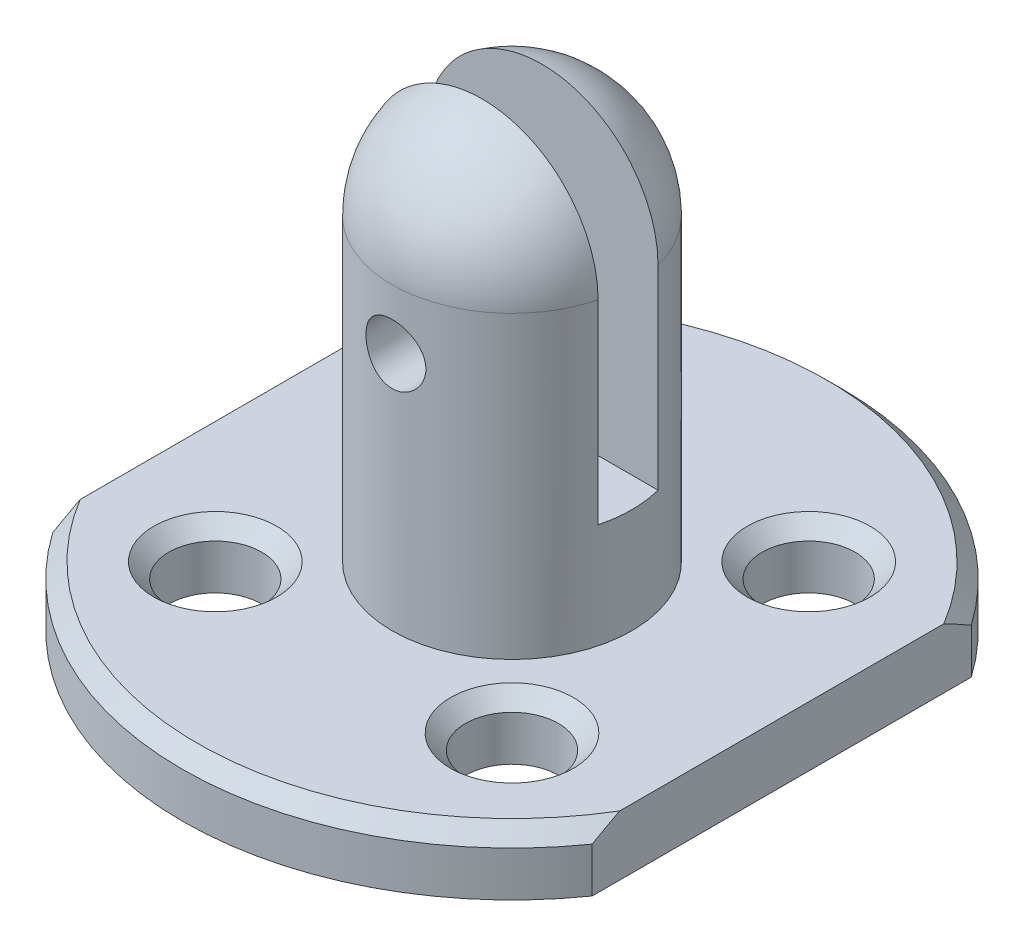
from build123d import *

# Parameters (mm, degrees)
BOSS_EXTRUDE1_DEPTH     = 2
SKETCH2_R               = 1.55
CUT_EXTRUDE1_DEPTH      = 15.352700094
CHAMFER1_SIZE           = 0.5
CUT_EXTRUDE2_DEPTH      = 22.400934559
CUT_EXTRUDE2_DEPTH_BACK = 22.400934559
SKETCH4_W               = 2
SKETCH4_H               = 13.963808783
CUT_EXTRUDE3_DEPTH      = 22.306139967
CUT_EXTRUDE3_DEPTH_BACK = 22.306139967
SKETCH5_R               = 1
SKETCH6_R               = 3
BOSS_EXTRUDE2_DEPTH     = 1


with BuildPart() as part:
    # Sketch1 → Boss-Extrude1 (new body)
    with BuildSketch(Plane(origin=(0, 0, 0), x_dir=(1, 0, 0), z_dir=(0, 1, 0))):
        with BuildLine():
            Line((9, -6.32455532), (9, 6.32455532))
            ThreePointArc((9, 6.32455532), (0, 11), (-9, 6.32455532))
            Line((-9, 6.32455532), (-9, -6.32455532))
            ThreePointArc((-9, -6.32455532), (0, -11), (9, -6.32455532))
        make_face()
    extrude(amount=BOSS_EXTRUDE1_DEPTH)

    # Sketch2 → Cut-Extrude1 (cut, through all)
    with BuildSketch(Plane(origin=(0, 2, 0), x_dir=(1, 0, 0), z_dir=(0, 1, 0))):
        with Locations(Location((4.949747468, 4.949747468, 0), (0, 0, 270))):
            Circle(SKETCH2_R)
        with Locations(Location((4.949747468, -4.949747468, 0), (0, 0, 270))):
            Circle(SKETCH2_R)
        with Locations(Location((-4.949747468, -4.949747468, 0), (0, 0, 270))):
            Circle(SKETCH2_R)
        with Locations(Location((-4.949747468, 4.949747468, 0), (0, 0, 270))):
            Circle(SKETCH2_R)
    extrude(amount=-CUT_EXTRUDE1_DEPTH, mode=Mode.SUBTRACT)

    # Chamfer1
    chamfer1_edges = [part.edges().sort_by_distance(p)[0] for p in [
        (0, 2, -11),
        (-4.949747468, 2, -6.499747468),
        (-4.949747468, 2, 3.399747468),
        (4.949747468, 2, 3.399747468),
        (4.949747468, 2, -6.499747468),
        (0, 2, 11),
    ]]
    chamfer(chamfer1_edges, length=CHAMFER1_SIZE)

    # Sketch3 → Revolve1 (revolve)
    with BuildSketch(Plane.XY):
        with BuildLine():
            Line((0, 2), (0, 16))
            ThreePointArc((0, 16), (2.828427125, 14.828427125), (4, 12))
            Line((4, 12), (4, 2))
            Line((4, 2), (0, 2))
        make_face()
    revolve(axis=Axis((0, 2, 0), (0, 1, 0)))

    # Sketch4 → Cut-Extrude2 (cut, two sides: drawn at the far end of the back side and taken through both)
    with BuildSketch(Plane(origin=(0, 0, 0), x_dir=(0, 0, -1), z_dir=(1, 0, 0)).offset(-CUT_EXTRUDE2_DEPTH_BACK)):
        with Locations((0, 12.481904392)):
            Rectangle(SKETCH4_W, SKETCH4_H)
    extrude(amount=CUT_EXTRUDE2_DEPTH + CUT_EXTRUDE2_DEPTH_BACK, mode=Mode.SUBTRACT)

    # Sketch5 → Cut-Extrude3 (cut, two sides: drawn at the far end of the back side and taken through both)
    with BuildSketch(Plane.XY.offset(-CUT_EXTRUDE3_DEPTH_BACK)):
        with Locations((0, 10)):
            Circle(SKETCH5_R)
    extrude(amount=CUT_EXTRUDE3_DEPTH + CUT_EXTRUDE3_DEPTH_BACK, mode=Mode.SUBTRACT)

    # Sketch6 → Boss-Extrude2 (add)
    with BuildSketch(Plane.XZ):
        with Locations(Location((0, 0, 0), (0, 0, 90))):
            Circle(SKETCH6_R)
    extrude(amount=BOSS_EXTRUDE2_DEPTH)


solid = part.part
